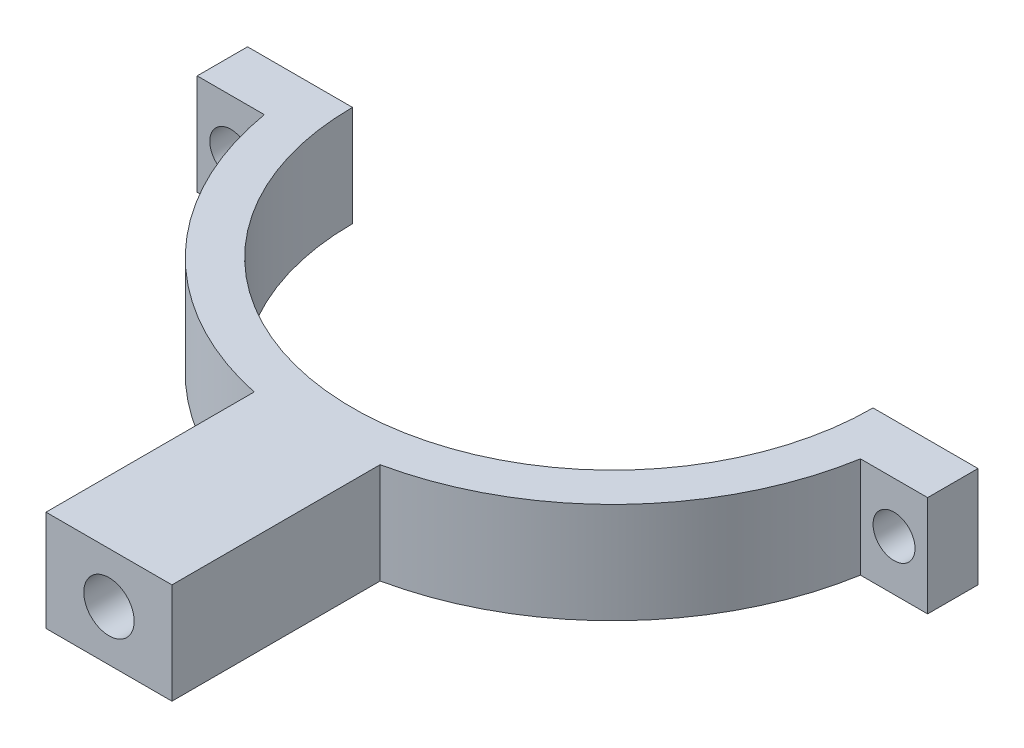
from build123d import *

# Parameters (mm, degrees)
BOSS_EXTRUDE1_DEPTH              = 15.24
TAP_DRILL_FOR_M10X1_0_TAP1_D     = 7.62
TAP_DRILL_FOR_M10X1_0_TAP1_DEPTH = 7.62
TAP_DRILL_FOR_M10X1_0_TAP1_TIP   = 2.289278958
TAP_DRILL_FOR_M10X1_0_TAP3_D     = 6.35
TAP_DRILL_FOR_M10X1_0_TAP3_DEPTH = 7.62
TAP_DRILL_FOR_M10X1_0_TAP3_TIP   = 1.907732465


with BuildPart() as part:
    # Sketch1 → Boss-Extrude1 (new body)
    with BuildSketch(Plane(origin=(0, 0, 0), x_dir=(1, 0, 0), z_dir=(0, 1, 0))):
        with BuildLine():
            Line((-39.37, 0), (-55.240527947, 0))
            Line((-55.240527947, 0), (-55.240527947, -7.62))
            Line((-55.240527947, -7.62), (-45.080527947, -7.62))
            ThreePointArc((-45.080527947, -7.62), (-33.007335275, -31.635963998), (-9.525, -44.716806404))
            Line((-9.525, -44.716806404), (-9.525, -76.2))
            Line((-9.525, -76.2), (9.525, -76.2))
            Line((9.525, -76.2), (9.525, -44.716806404))
            ThreePointArc((9.525, -44.716806404), (33.007335275, -31.635963998), (45.080527947, -7.62))
            Line((45.080527947, -7.62), (55.240527947, -7.62))
            Line((55.240527947, -7.62), (55.240527947, 0))
            Line((55.240527947, 0), (39.37, 0))
            ThreePointArc((39.37, 0), (0, -39.37), (-39.37, 0))
        make_face()
    extrude(amount=BOSS_EXTRUDE1_DEPTH)

    # Tap Drill for M10x1.0 Tap1
    with Locations(Plane.XY.offset(76.2)):
        with Locations((0, 7.62)):
            Hole(TAP_DRILL_FOR_M10X1_0_TAP1_D / 2, depth=TAP_DRILL_FOR_M10X1_0_TAP1_DEPTH)
            with Locations((0, 0, -(TAP_DRILL_FOR_M10X1_0_TAP1_DEPTH + TAP_DRILL_FOR_M10X1_0_TAP1_TIP / 2))):  # 118° drill point
                Cone(0, TAP_DRILL_FOR_M10X1_0_TAP1_D / 2, TAP_DRILL_FOR_M10X1_0_TAP1_TIP, mode=Mode.SUBTRACT)

    # Tap Drill for M10x1.0 Tap3
    with Locations(Plane.XY.offset(7.62)):
        with Locations((-50.160527947, 7.62), (50.160527947, 7.62)):
            Hole(TAP_DRILL_FOR_M10X1_0_TAP3_D / 2, depth=TAP_DRILL_FOR_M10X1_0_TAP3_DEPTH)
            with Locations((0, 0, -(TAP_DRILL_FOR_M10X1_0_TAP3_DEPTH + TAP_DRILL_FOR_M10X1_0_TAP3_TIP / 2))):  # 118° drill point
                Cone(0, TAP_DRILL_FOR_M10X1_0_TAP3_D / 2, TAP_DRILL_FOR_M10X1_0_TAP3_TIP, mode=Mode.SUBTRACT)


solid = part.part
